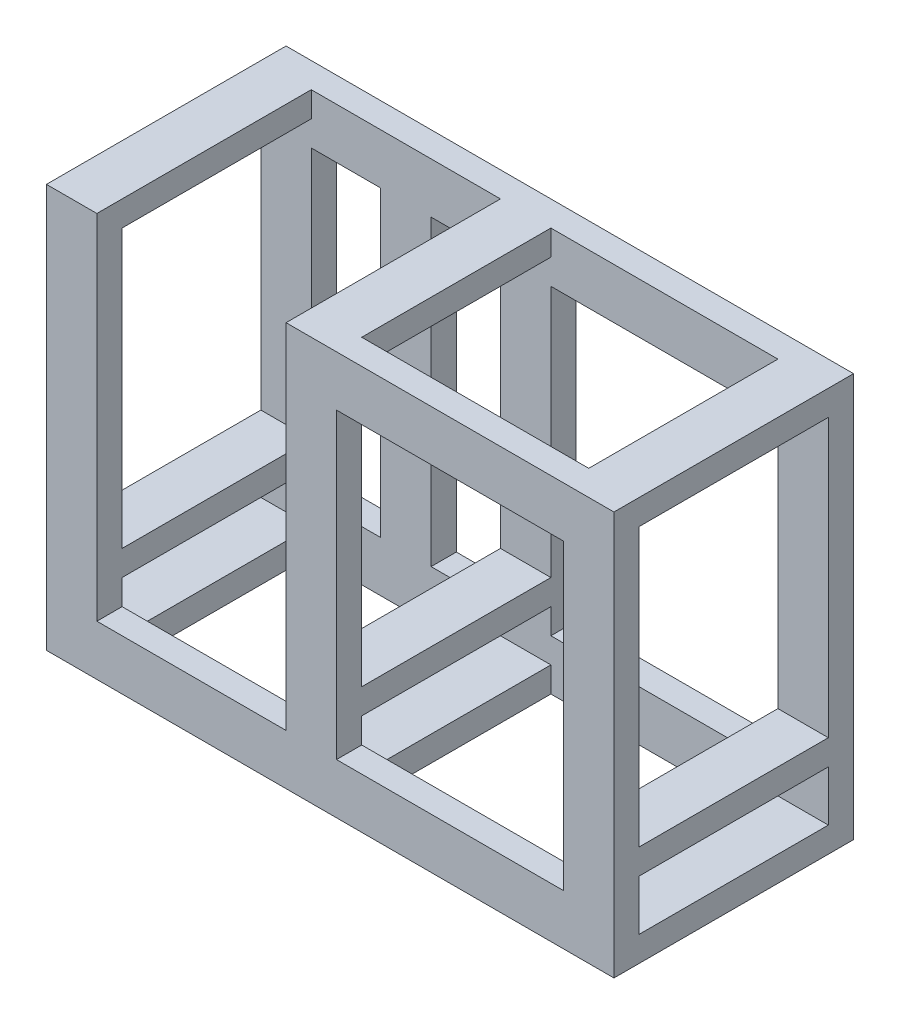
from build123d import *

# Parameters (mm, degrees)
SKETCH1_W             = 190.5
SKETCH1_H             = 25.4
BOSS_EXTRUDE1_DEPTH   = 50.8
BOSS_EXTRUDE1_2_DEPTH = 50.8
SKETCH1_W_2           = 228.6
BOSS_EXTRUDE1_3_DEPTH = 50.8
BOSS_EXTRUDE1_4_DEPTH = 50.8
SKETCH1_3_W           = 50.8
SKETCH1_3_H           = 190.5
BOSS_EXTRUDE2_DEPTH   = 25.4
BOSS_EXTRUDE2_2_DEPTH = 25.4
BOSS_EXTRUDE2_3_DEPTH = 25.4
SKETCH1_4_W           = 50.8
SKETCH1_4_H           = 25.4
BOSS_EXTRUDE3_DEPTH   = 406.4
SKETCH2_W             = 228.6
SKETCH2_H             = 25.4
SKETCH2_W_2           = 69.85
BOSS_EXTRUDE8_DEPTH   = 50.8
SKETCH2_3_W           = 50.8
SKETCH2_3_H           = 190.5
BOSS_EXTRUDE9_DEPTH   = 25.4
SKETCH2_4_W           = 50.8
SKETCH2_4_H           = 25.4
BOSS_EXTRUDE10_DEPTH  = 355.6
SKETCH3_W             = 50.8
SKETCH3_H             = 25.4
BOSS_EXTRUDE11_DEPTH  = 190.5


with BuildPart() as part:
    # Sketch1 → Boss-Extrude1 (new body)
    with BuildSketch(Plane(origin=(0, 0, 0), x_dir=(1, 0, 0), z_dir=(0, 1, 0))):
        with Locations((-95.25, 12.7)):
            Rectangle(SKETCH1_W, SKETCH1_H)
    extrude(amount=BOSS_EXTRUDE1_DEPTH)


with BuildPart() as body_2:
    # Sketch1 → Boss-Extrude1 2 (new body)
    with BuildSketch(Plane(origin=(0, 0, 0), x_dir=(1, 0, 0), z_dir=(0, 1, 0))):
        with Locations((-95.25, 228.6)):
            Rectangle(SKETCH1_W, SKETCH1_H)
    extrude(amount=BOSS_EXTRUDE1_2_DEPTH)



with BuildPart() as body_3:
    # Sketch1 → Boss-Extrude1 3 (new body)
    with BuildSketch(Plane(origin=(0, 0, 0), x_dir=(1, 0, 0), z_dir=(0, 1, 0))):
        with Locations((165.1, 228.6)):
            Rectangle(SKETCH1_W_2, SKETCH1_H)
    extrude(amount=BOSS_EXTRUDE1_3_DEPTH)



with BuildPart() as body_4:
    # Sketch1 → Boss-Extrude1 4 (new body)
    with BuildSketch(Plane(origin=(0, 0, 0), x_dir=(1, 0, 0), z_dir=(0, 1, 0))):
        with Locations((165.1, 12.7)):
            Rectangle(SKETCH1_W_2, SKETCH1_H)
    extrude(amount=BOSS_EXTRUDE1_4_DEPTH)


with BuildPart() as body_5:
    # Sketch1<3> → Boss-Extrude2 (new body)
    with BuildSketch(Plane(origin=(0, 0, 0), x_dir=(1, 0, 0), z_dir=(0, 1, 0))):
        with Locations((25.4, 120.65)):
            Rectangle(SKETCH1_3_W, SKETCH1_3_H)
    extrude(amount=BOSS_EXTRUDE2_DEPTH)


with BuildPart() as body_6:
    # Sketch1<3> → Boss-Extrude2 2 (new body)
    with BuildSketch(Plane(origin=(0, 0, 0), x_dir=(1, 0, 0), z_dir=(0, 1, 0))):
        with Locations((304.8, 120.65)):
            Rectangle(SKETCH1_3_W, SKETCH1_3_H)
    extrude(amount=BOSS_EXTRUDE2_2_DEPTH)


with BuildPart() as body_7:
    # Sketch1<3> → Boss-Extrude2 3 (new body)
    with BuildSketch(Plane(origin=(0, 0, 0), x_dir=(1, 0, 0), z_dir=(0, 1, 0))):
        with Locations((-215.9, 120.65)):
            Rectangle(SKETCH1_3_W, SKETCH1_3_H)
    extrude(amount=BOSS_EXTRUDE2_3_DEPTH)


with BuildPart() as body_3_1:
    add(body_3.part)

    add(body_6.part)  # Boss-Extrude3 merges body 6

    add(body_4.part)  # Boss-Extrude3 merges body 4

    add(part.part)  # Boss-Extrude3 merges part

    add(body_7.part)  # Boss-Extrude3 merges body 7
    # Sketch1<4> → Boss-Extrude3 (add)
    with BuildSketch(Plane(origin=(0, 0, 0), x_dir=(1, 0, 0), z_dir=(0, 1, 0))):
        with Locations((25.4, 12.7)):
            Rectangle(SKETCH1_4_W, SKETCH1_4_H)
        with Locations((25.4, 228.6)):
            Rectangle(SKETCH1_4_W, SKETCH1_4_H)
        with Locations((304.8, 228.6)):
            Rectangle(SKETCH1_4_W, SKETCH1_4_H)
        with Locations((304.8, 12.7)):
            Rectangle(SKETCH1_4_W, SKETCH1_4_H)
        with Locations((-215.9, 12.7)):
            Rectangle(SKETCH1_4_W, SKETCH1_4_H)
        with Locations((-215.9, 228.6)):
            Rectangle(SKETCH1_4_W, SKETCH1_4_H)
    extrude(amount=BOSS_EXTRUDE3_DEPTH)

    # Sketch2 → Boss-Extrude8 (add)
    with BuildSketch(Plane(origin=(0, 406.4, 0), x_dir=(1, 0, 0), z_dir=(0, 1, 0))):
        with Locations((165.1, 228.6)):
            Rectangle(SKETCH2_W, SKETCH2_H)
        with Locations((-34.925, 228.6)):
            Rectangle(SKETCH2_W_2, SKETCH2_H)
        with Locations((-155.575, 228.6)):
            Rectangle(SKETCH2_W_2, SKETCH2_H)
        with Locations((165.1, 12.7)):
            Rectangle(SKETCH2_W, SKETCH2_H)
    extrude(amount=-BOSS_EXTRUDE8_DEPTH)

    # Sketch2<3> → Boss-Extrude9 (add)
    with BuildSketch(Plane(origin=(0, 406.4, 0), x_dir=(1, 0, 0), z_dir=(0, 1, 0))):
        with Locations((25.4, 120.65)):
            Rectangle(SKETCH2_3_W, SKETCH2_3_H)
        with Locations((304.8, 120.65)):
            Rectangle(SKETCH2_3_W, SKETCH2_3_H)
        with Locations((-215.9, 120.65)):
            Rectangle(SKETCH2_3_W, SKETCH2_3_H)
    extrude(amount=-BOSS_EXTRUDE9_DEPTH)


with BuildPart() as body_2_1:
    add(body_2.part)

    add(body_3_1.part)  # Boss-Extrude10 merges body 3
    # Sketch2<4> → Boss-Extrude10 (add)
    with BuildSketch(Plane(origin=(0, 406.4, 0), x_dir=(1, 0, 0), z_dir=(0, 1, 0))):
        with Locations((-95.25, 228.6)):
            Rectangle(SKETCH2_4_W, SKETCH2_4_H)
    extrude(amount=-BOSS_EXTRUDE10_DEPTH)

    # Sketch3 → Boss-Extrude11 (add)
    with BuildSketch(Plane.XY.offset(-215.9)):
        with Locations((-215.9, 88.9)):
            Rectangle(SKETCH3_W, SKETCH3_H)
        with Locations((25.4, 88.9)):
            Rectangle(SKETCH3_W, SKETCH3_H)
        with Locations((304.8, 88.9)):
            Rectangle(SKETCH3_W, SKETCH3_H)
    extrude(amount=BOSS_EXTRUDE11_DEPTH)


solid = Compound([body_5.part, body_2_1.part])
